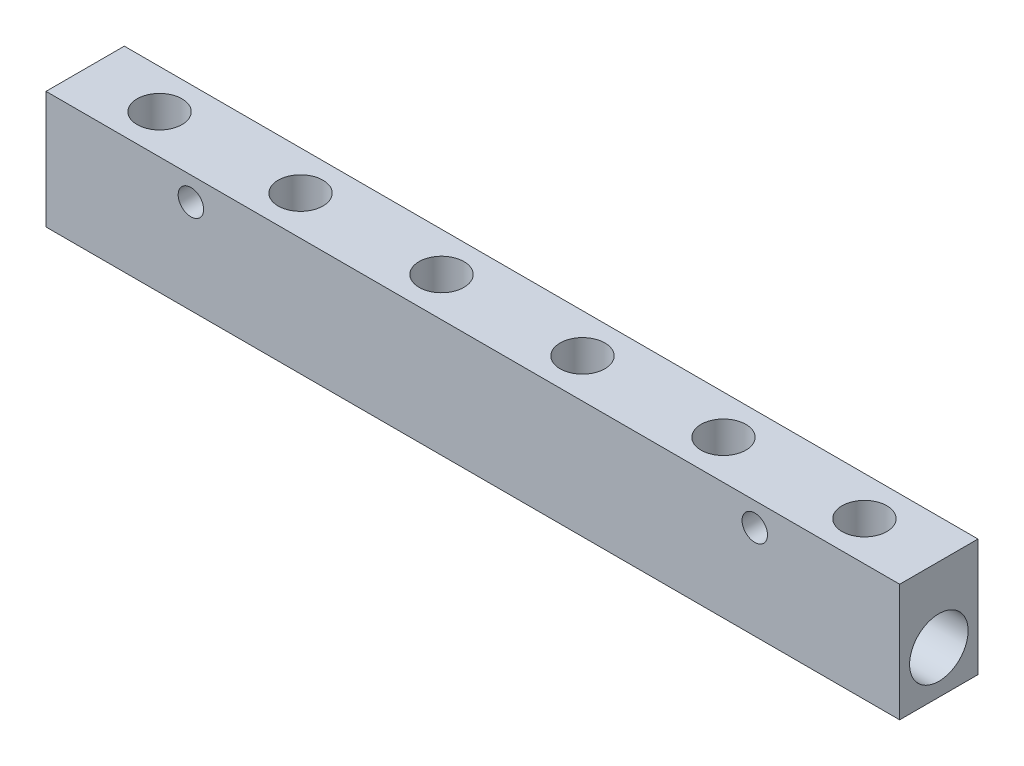
from build123d import *

# Parameters (mm, degrees)
SKETCH1_W           = 218
SKETCH1_H           = 20
BOSS_EXTRUDE1_DEPTH = 30
SKETCH2_R           = 3.25
CUT_EXTRUDE1_DEPTH  = 30
SKETCH3_R           = 7.475
CUT_EXTRUDE2_DEPTH  = 221.281637909
SKETCH4_R           = 5.7225
CUT_EXTRUDE3_DEPTH  = 15


with BuildPart() as part:
    # Sketch1 → Boss-Extrude1 (new body)
    with BuildSketch(Plane(origin=(0, 0, 0), x_dir=(1, 0, 0), z_dir=(0, 1, 0))):
        Rectangle(SKETCH1_W, SKETCH1_H)
    extrude(amount=BOSS_EXTRUDE1_DEPTH)

    # Sketch2 → Cut-Extrude1 (cut)
    with BuildSketch(Plane.XY.offset(10)):
        with Locations((-72, 24)):
            Circle(SKETCH2_R)
        with Locations((72, 24)):
            Circle(SKETCH2_R)
    extrude(amount=-CUT_EXTRUDE1_DEPTH, mode=Mode.SUBTRACT)

    # Sketch3 → Cut-Extrude2 (cut, through all)
    with BuildSketch(Plane.ZY.offset(109)):
        with Locations((0, 11)):
            Circle(SKETCH3_R)
    extrude(amount=-CUT_EXTRUDE2_DEPTH, mode=Mode.SUBTRACT)

    # Sketch4 → Cut-Extrude3 (cut)
    with BuildSketch(Plane(origin=(0, 30, 0), x_dir=(1, 0, 0), z_dir=(0, 1, 0))):
        with Locations(Location((-90, 0, 0), (0, 0, 270))):
            Circle(SKETCH4_R)
        with Locations(Location((-54, 0, 0), (0, 0, 270))):
            Circle(SKETCH4_R)
        with Locations(Location((-18, 0, 0), (0, 0, 270))):
            Circle(SKETCH4_R)
        with Locations(Location((90, 0, 0), (0, 0, 270))):
            Circle(SKETCH4_R)
        with Locations(Location((18, 0, 0), (0, 0, 270))):
            Circle(SKETCH4_R)
        with Locations(Location((54, 0, 0), (0, 0, 270))):
            Circle(SKETCH4_R)
    extrude(amount=-CUT_EXTRUDE3_DEPTH, mode=Mode.SUBTRACT)


solid = part.part
